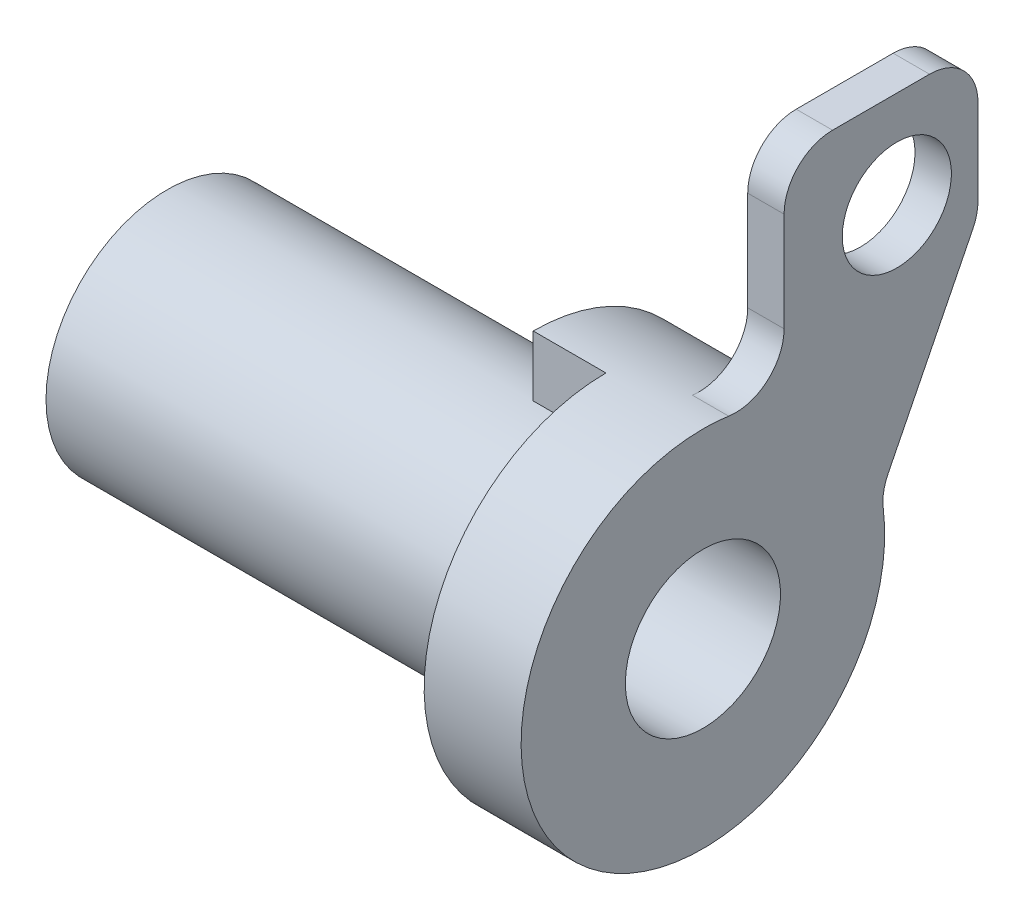
from build123d import *

# Parameters (mm, degrees)
SKIZZE1_W                       = 22.1
SKIZZE1_H                       = 4.3
SCHNITT_LINEAR_START            = -15.1
SKIZZE2_R                       = 7.5
SKIZZE2_R_2                     = 5
SCHNITT_LINEAR_AUSTRAGEN2_DEPTH = 15.1
SCHNITT_LINEAR_START_2          = -3
SCHNITT_LINEAR_AUSTRAGEN4_DEPTH = 3
AUFSATZ_LINEAR_AUSTRAGEN1_DEPTH = 1.5
DURCHGANGSLOCH_F_R_M41_D        = 4.5
VERRUNDUNG3_R                   = 2


with BuildPart() as part:
    # Skizze1 → Rotation1 (revolve)
    with BuildSketch(Plane.XY, mode=Mode.PRIVATE) as rotation1_sk:
        with Locations((11.05, 5.35)):
            Rectangle(SKIZZE1_W, SKIZZE1_H)
    revolve(rotation1_sk.sketch.rotate(Axis((0, 0, 0), (1, 0, 0)), 90), axis=Axis((0, 0, 0), (1, 0, 0)))

    # Skizze2 → Schnitt-Linear austragen2 (cut)
    with BuildSketch(Plane.ZY.offset(SCHNITT_LINEAR_START)):
        Circle(SKIZZE2_R)
        Circle(SKIZZE2_R_2, mode=Mode.SUBTRACT)
    extrude(amount=SCHNITT_LINEAR_AUSTRAGEN2_DEPTH, mode=Mode.SUBTRACT)

    # Skizze3 → Schnitt-Linear austragen4 (cut)
    with BuildSketch(Plane.ZY.offset(-15.1).offset(SCHNITT_LINEAR_START_2)):
        with BuildLine():
            Line((0, 5), (0, 7.5))
            ThreePointArc((0, 7.5), (7.451278665, -0.853490626), (-1.695892399, -7.305747667))
            Line((-1.695892399, -7.305747667), (0.652630961, -4.957224307))
            ThreePointArc((0.652630961, -4.957224307), (4.989294616, 0.327015646), (0, 5))
        make_face()
    extrude(amount=SCHNITT_LINEAR_AUSTRAGEN4_DEPTH, mode=Mode.SUBTRACT)

    # Skizze4 → Aufsatz-Linear austragen1 (add)
    with BuildSketch(Plane(origin=(22.1, 0, 0), x_dir=(0, 0, -1), z_dir=(1, 0, 0))):
        with BuildLine():
            Line((3.348469228, 6.711017347), (3.348469228, 15.5))
            Line((3.348469228, 15.5), (11.348469228, 15.5))
            Line((11.348469228, 15.5), (11.348469228, 9.5))
            Line((11.348469228, 9.5), (7.348469228, 1.5))
            ThreePointArc((7.348469228, 1.5), (5.949352783, 4.566749552), (3.348469228, 6.711017347))
        make_face()
    extrude(amount=-AUFSATZ_LINEAR_AUSTRAGEN1_DEPTH)

    # Durchgangsloch für M41 (through all)
    with Locations(Plane.ZY.offset(-18.1)):
        with Locations((-8, 11.5)):
            Hole(DURCHGANGSLOCH_F_R_M41_D / 2)

    # Verrundung3
    verrundung3_edges = [part.edges().sort_by_distance(p)[0] for p in [
        (21.35, 1.5, -7.348469228),
        (21.35, 6.711017347, -3.348469228),
        (21.35, 15.5, -3.348469228),
        (21.35, 15.5, -11.348469228),
        (21.35, 9.5, -11.348469228),
    ]]
    fillet(verrundung3_edges, radius=VERRUNDUNG3_R)


solid = part.part
